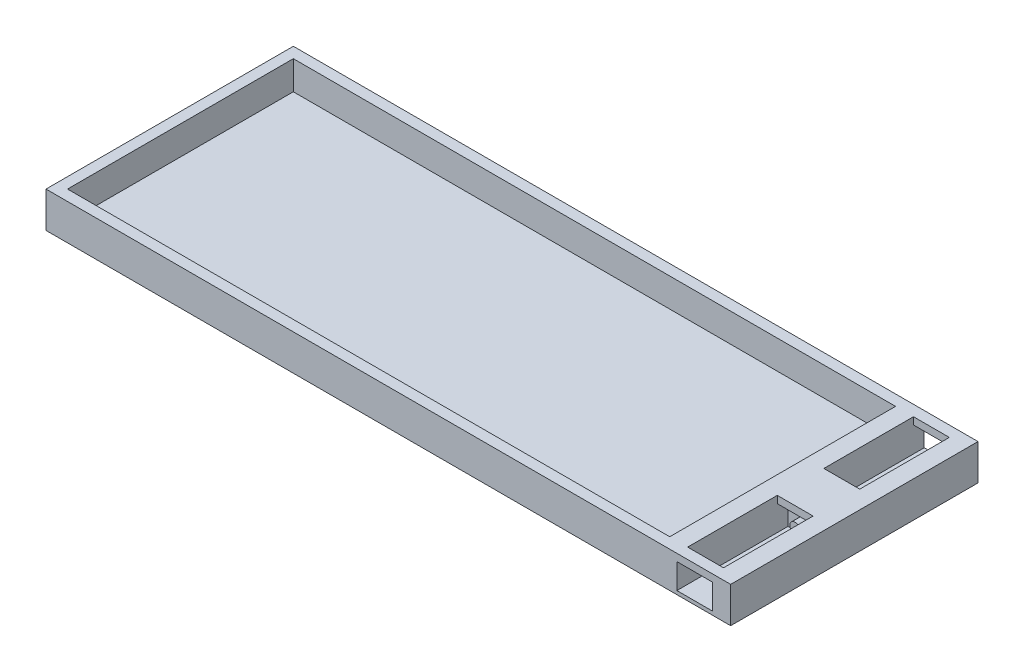
from build123d import *

# Parameters (mm, degrees)
SKETCH1_W                      = 168
SKETCH1_H                      = 63
BOSS_EXTRUDE1_DEPTH            = 10
SKETCH2_W                      = 168
SKETCH2_H                      = 63
BOSS_EXTRUDE2_DEPTH            = 2
SKETCH3_W                      = 10
SKETCH3_H                      = 25
CUT_EXTRUDE1_DEPTH             = 111.028405423
SKETCH4_W                      = 10
SKETCH4_H                      = 8
CUT_EXTRUDE2_DEPTH             = 3
CUT_EXTRUDE2_DIRECTION_2_REACH = 114.236
SKETCH6_W                      = 10
SKETCH6_H                      = 1
BOSS_EXTRUDE4_DEPTH            = 31
SKETCH7_R                      = 1.5
BOSS_EXTRUDE5_DEPTH            = 3
SKETCH8_W                      = 10
SKETCH8_H                      = 5
BOSS_EXTRUDE6_DEPTH            = 3


with BuildPart() as part:
    # Sketch1 → Boss-Extrude1 (new body)
    with BuildSketch(Plane(origin=(0, 0, 0), x_dir=(1, 0, 0), z_dir=(0, 1, 0))):
        Polygon((0, 34.5), (-87, 34.5), (-87, -34.5), (84, -34.5), (104, -34.5), (104, 34.5), (84, 34.5), align=None)
        Rectangle(SKETCH1_W, SKETCH1_H, mode=Mode.SUBTRACT)
    extrude(amount=BOSS_EXTRUDE1_DEPTH)

    # Sketch2 → Boss-Extrude2 (add)
    with BuildSketch(Plane(origin=(0, 0, 0), x_dir=(1, 0, 0), z_dir=(0, 1, 0))):
        Rectangle(SKETCH2_W, SKETCH2_H)
    extrude(amount=BOSS_EXTRUDE2_DEPTH)

    # Sketch3 → Cut-Extrude1 (cut, through all)
    with BuildSketch(Plane(origin=(0, 10, 0), x_dir=(1, 0, 0), z_dir=(0, 1, 0))):
        with Locations((94, 19)):
            Rectangle(SKETCH3_W, SKETCH3_H)
    cut_extrude1 = extrude(amount=-CUT_EXTRUDE1_DEPTH, mode=Mode.SUBTRACT)

    # Mirror1: Cut-Extrude1 across plane
    add(cut_extrude1.mirror(Plane.XY), mode=Mode.SUBTRACT)

    # Sketch4 → Cut-Extrude2 (cut)
    with BuildSketch(Plane.XY.offset(6.5)):
        with Locations((94, 4)):
            Rectangle(SKETCH4_W, SKETCH4_H)
    cut_extrude2 = extrude(amount=-CUT_EXTRUDE2_DEPTH, mode=Mode.SUBTRACT)

    # Sketch4 → Cut-Extrude2 direction 2 (cut, up to next)
    with BuildSketch(Plane.XY.offset(6.5), mode=Mode.PRIVATE) as cut_extrude2_direction_2_sk1:
        with Locations((94, 4)):
            Rectangle(SKETCH4_W, SKETCH4_H)
    cut_extrude2_direction_2_tool1 = extrude(cut_extrude2_direction_2_sk1.sketch, amount=CUT_EXTRUDE2_DIRECTION_2_REACH, mode=Mode.PRIVATE) & part.part
    cut_extrude2_direction_2 = cut_extrude2_direction_2_tool1.solids().sort_by_distance((94, 4, 6.5))[0]
    add(cut_extrude2_direction_2, mode=Mode.SUBTRACT)

    # Mirror2: Cut-Extrude2, Cut-Extrude2 direction 2 across plane
    add(cut_extrude2.mirror(Plane.XY), mode=Mode.SUBTRACT)
    add(cut_extrude2_direction_2.mirror(Plane.XY), mode=Mode.SUBTRACT)

    # Sketch6 → Boss-Extrude4 (add)
    with BuildSketch(Plane.XY.offset(3.5)):
        with Locations((94, 0.5)):
            Rectangle(SKETCH6_W, SKETCH6_H)
    boss_extrude4 = extrude(amount=BOSS_EXTRUDE4_DEPTH)

    # Mirror5: Boss-Extrude4 across plane
    add(boss_extrude4.mirror(Plane.XY))

    # Sketch7 → Boss-Extrude5 (add)
    with BuildSketch(Plane.XY.offset(3.5)):
        with Locations((94, 4.5)):
            Circle(SKETCH7_R)
    boss_extrude5 = extrude(amount=BOSS_EXTRUDE5_DEPTH)

    # Mirror6: Boss-Extrude5 across plane
    add(boss_extrude5.mirror(Plane.XY))

    # Sketch8 → Boss-Extrude6 (add)
    with BuildSketch(Plane.ZY.offset(87)):
        with Locations((0, 2.5)):
            Rectangle(SKETCH8_W, SKETCH8_H)
    extrude(amount=BOSS_EXTRUDE6_DEPTH)


solid = part.part
